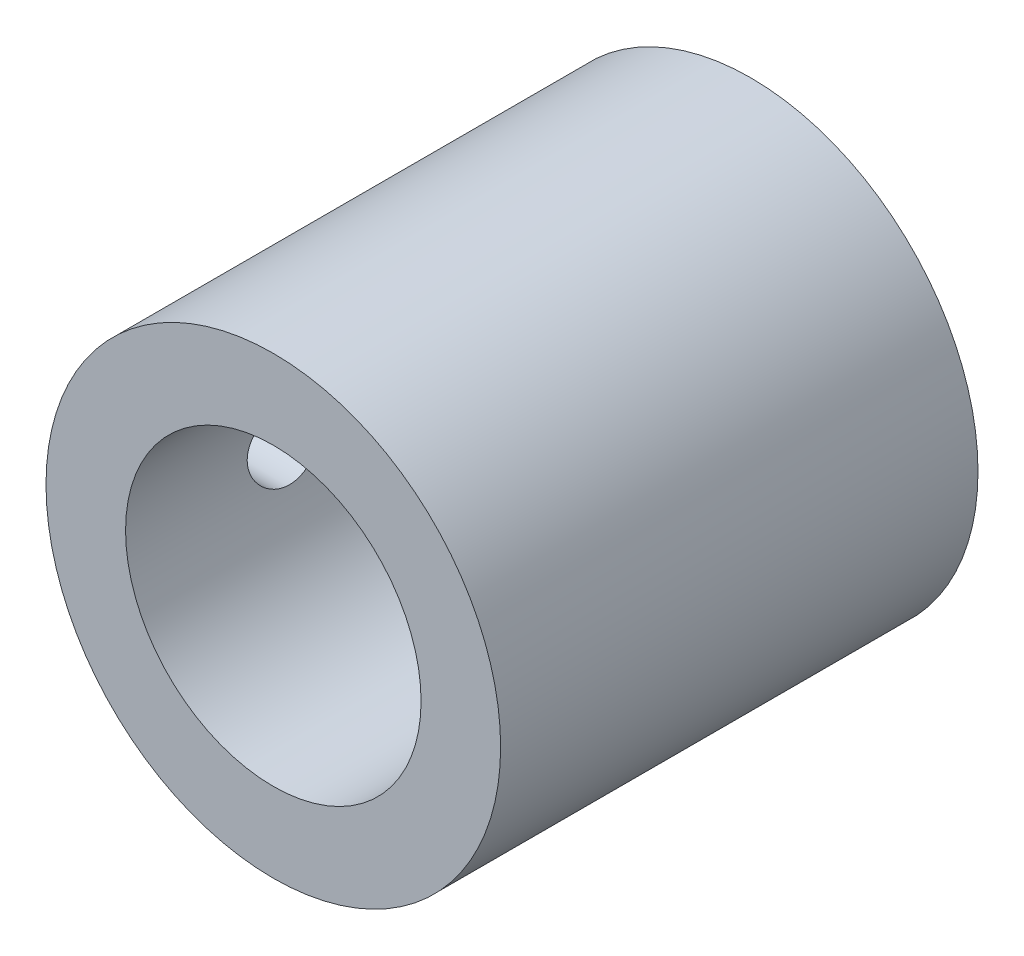
from build123d import *

# Parameters (mm, degrees)
SKETCH_1_R                  = 10
EXTRUDE_1_DEPTH             = 21
SKETCH_2_R                  = 6.5
CUT_EXTRUDE_1_DEPTH         = 15
M4X0_71_D                   = 3.3
M4X0_71_DEPTH               = 5
M4X0_71_TIP                 = 0.991420021
M3X0_51_D                   = 2.5
M3X0_51_DEPTH               = 6
HOLE_WIZARD_M31_D           = 3.4
HOLE_WIZARD_M31_CBORE_D     = 6.7
HOLE_WIZARD_M31_CBORE_DEPTH = 1.8


with BuildPart() as part:
    # Эскиз1 → Бобышка-Вытянуть1 (new body)
    with BuildSketch(Plane.XY):
        with Locations(Location((0, 0, 0), (0, 0, 180))):
            Circle(SKETCH_1_R)
    extrude(amount=EXTRUDE_1_DEPTH)

    # Эскиз2 → Вырез-Вытянуть1 (cut)
    with BuildSketch(Plane.XY.offset(21)):
        Circle(SKETCH_2_R)
    extrude(amount=-CUT_EXTRUDE_1_DEPTH, mode=Mode.SUBTRACT)

    # Отверстие обработанное метчиком M4x0.71
    with Locations(Plane(origin=(-10, 0, 0), x_dir=(0, 0, -1), z_dir=(-1, 0, 0))):
        with Locations((-14, 0)):
            Hole(M4X0_71_D / 2, depth=M4X0_71_DEPTH)
            with Locations((0, 0, -(M4X0_71_DEPTH + M4X0_71_TIP / 2))):  # 118° drill point
                Cone(0, M4X0_71_D / 2, M4X0_71_TIP, mode=Mode.SUBTRACT)

    # Отверстие обработанное метчиком M3x0.51
    with Locations(Plane(origin=(0, 0, 0), x_dir=(-1, 0, 0), z_dir=(0, 0, -1))):
        with Locations((-4.242640687, 4.242640687), (4.242640687, 4.242640687), (4.242640687, -4.242640687), (-4.242640687, -4.242640687)):
            Hole(M3X0_51_D / 2, depth=M3X0_51_DEPTH)

    # Цековка для  винта с полукруглой головкой M31 (through all)
    with Locations(Plane(origin=(0, 0, 0), x_dir=(-1, 0, 0), z_dir=(0, 0, -1))):
        with Locations((0, 0)):
            CounterBoreHole(HOLE_WIZARD_M31_D / 2, HOLE_WIZARD_M31_CBORE_D / 2, HOLE_WIZARD_M31_CBORE_DEPTH)


solid = part.part
